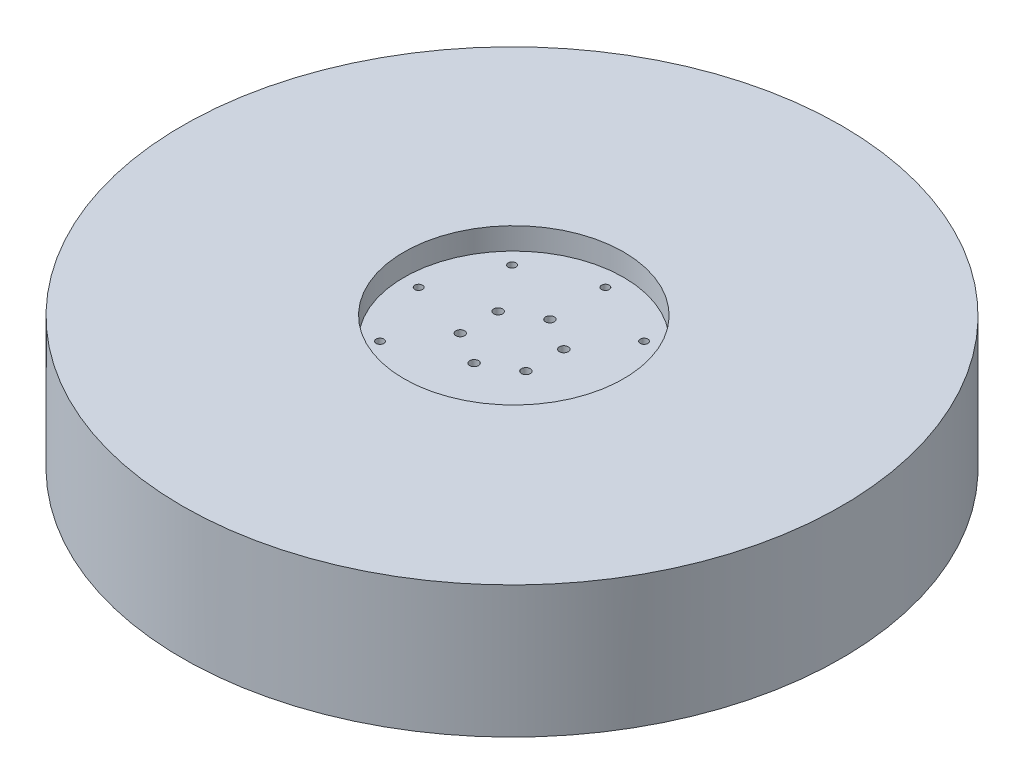
from build123d import *

# Parameters (mm, degrees)
SKETCH_1_R          = 150
SKETCH_1_R_2        = 2
SKETCH_1_R_3        = 1.75
EXTRUDE_2_DEPTH     = 25
SKETCH_2_R          = 29.5
CUT_EXTRUDE_1_DEPTH = 6.6
SKETCH_3_R          = 50
CUT_EXTRUDE_2_DEPTH = 10
EXTRUDE_START       = 35
SKETCH_10_R         = 150
SKETCH_10_R_2       = 130
EXTRUDE_7_DEPTH     = 35


with BuildPart() as part:
    # 草图1 → 凸台-拉伸2 (new body)
    with BuildSketch(Plane(origin=(0, 0, 0), x_dir=(1, 0, 0), z_dir=(0, 1, 0))):
        with Locations(Location((-17.091633393, 0.301972321, 0), (0, 0, 270))):
            Circle(SKETCH_1_R)
        with Locations(Location((-17.091633393, 17.551972321, 0), (0, 0, 270))):
            Circle(SKETCH_1_R_2, mode=Mode.SUBTRACT)
        with Locations(Location((-17.091633393, 42.801972321, 0), (0, 0, 270))):
            Circle(SKETCH_1_R_3, mode=Mode.SUBTRACT)
        with Locations(Location((12.960404807, 30.354010522, 0), (0, 0, 270))):
            Circle(SKETCH_1_R_3, mode=Mode.SUBTRACT)
        with Locations(Location((25.408366607, 0.301972321, 0), (0, 0, 270))):
            Circle(SKETCH_1_R_3, mode=Mode.SUBTRACT)
        with Locations(Location((12.960404807, -29.750065879, 0), (0, 0, 270))):
            Circle(SKETCH_1_R_3, mode=Mode.SUBTRACT)
        with Locations(Location((-17.091633393, -42.198027679, 0), (0, 0, 270))):
            Circle(SKETCH_1_R_3, mode=Mode.SUBTRACT)
        with Locations(Location((-47.143671594, -29.750065879, 0), (0, 0, 270))):
            Circle(SKETCH_1_R_3, mode=Mode.SUBTRACT)
        with Locations(Location((-59.591633393, 0.301972321, 0), (0, 0, 270))):
            Circle(SKETCH_1_R_3, mode=Mode.SUBTRACT)
        with Locations(Location((-47.143671594, 30.354010522, 0), (0, 0, 270))):
            Circle(SKETCH_1_R_3, mode=Mode.SUBTRACT)
        with Locations(Location((-2.152695178, 8.926972321, 0), (0, 0, 270))):
            Circle(SKETCH_1_R_2, mode=Mode.SUBTRACT)
        with Locations(Location((-2.152695178, -8.323027679, 0), (0, 0, 270))):
            Circle(SKETCH_1_R_2, mode=Mode.SUBTRACT)
        with Locations(Location((-17.091633393, -16.948027679, 0), (0, 0, 270))):
            Circle(SKETCH_1_R_2, mode=Mode.SUBTRACT)
        with Locations(Location((-32.030571609, -8.323027679, 0), (0, 0, 270))):
            Circle(SKETCH_1_R_2, mode=Mode.SUBTRACT)
        with Locations(Location((-32.030571609, 8.926972321, 0), (0, 0, 270))):
            Circle(SKETCH_1_R_2, mode=Mode.SUBTRACT)
    extrude(amount=EXTRUDE_2_DEPTH)

    # 草图2 → 切除-拉伸1 (cut)
    with BuildSketch(Plane.XZ):
        with Locations(Location((-17.091633393, -0.301972321, 0), (0, 0, 270))):
            Circle(SKETCH_2_R)
    extrude(amount=-CUT_EXTRUDE_1_DEPTH, mode=Mode.SUBTRACT)

    # 草图3 → 切除-拉伸2 (cut)
    with BuildSketch(Plane(origin=(0, 25, 0), x_dir=(1, 0, 0), z_dir=(0, 1, 0))):
        with Locations(Location((-16.888033671, 0.912771488, 0), (0, 0, 270))):
            Circle(SKETCH_3_R)
    extrude(amount=-CUT_EXTRUDE_2_DEPTH, mode=Mode.SUBTRACT)

    # 草图10 → 凸台-拉伸7 (add)
    with BuildSketch(Plane.XZ.offset(EXTRUDE_START)):
        with Locations(Location((-17.091633393, -0.301972321, 0), (0, 0, 270))):
            Circle(SKETCH_10_R)
        with Locations(Location((-17.091633393, -0.301972321, 0), (0, 0, 270))):
            Circle(SKETCH_10_R_2, mode=Mode.SUBTRACT)
    extrude(amount=-EXTRUDE_7_DEPTH)


solid = part.part
